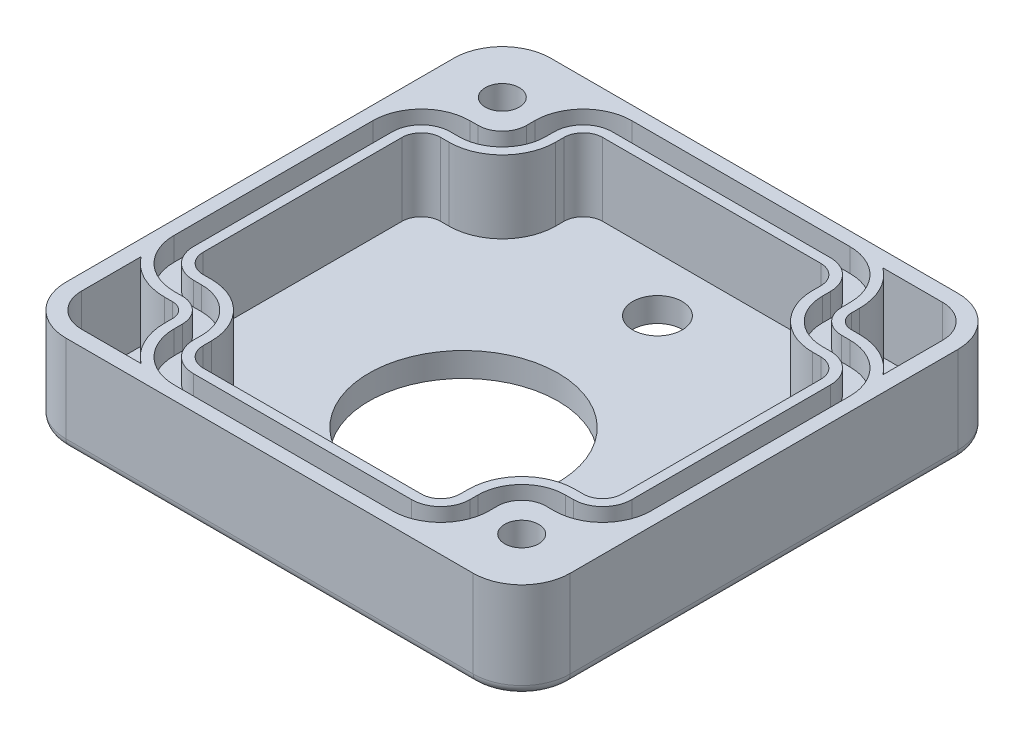
from build123d import *

# Parameters (mm, degrees)
EXTRUDE_1_DEPTH      = 10
CUT_EXTRUDE_START    = 2.5
CUT_EXTRUDE_1_DEPTH  = 7.5
CUT_EXTRUDE_START_2  = 10
CUT_EXTRUDE_7_DEPTH  = 2.4
CUT_EXTRUDE_START_3  = 2
CUT_EXTRUDE_9_DEPTH  = 8
SKETCH_15_R          = 1.75
CUT_EXTRUDE_10_DEPTH = 10
SKETCH_16_R          = 2.35
CUT_EXTRUDE_11_DEPTH = 6
SKETCH_17_R          = 4
CUT_EXTRUDE_12_DEPTH = 3
FILLET_2_R           = 1
SKETCH_18_R          = 9.75
SKETCH_18_R_2        = 2.55
CUT_EXTRUDE_13_DEPTH = 10


with BuildPart() as part:
    # Эскиз1 → Бобышка-Вытянуть1 (new body)
    with BuildSketch(Plane(origin=(0, 0, 0), x_dir=(1, 0, 0), z_dir=(0, 1, 0))):
        with BuildLine():
            Line((-21, 25), (21, 25))
            ThreePointArc((21, 25), (24.535533906, 23.535533906), (26, 20))
            Line((26, 20), (26, -20))
            ThreePointArc((26, -20), (24.535533906, -23.535533906), (21, -25))
            Line((21, -25), (-21, -25))
            ThreePointArc((-21, -25), (-24.535533906, -23.535533906), (-26, -20))
            Line((-26, -20), (-26, 20))
            ThreePointArc((-26, 20), (-24.535533906, 23.535533906), (-21, 25))
        make_face()
    extrude(amount=EXTRUDE_1_DEPTH)

    # Эскиз2 → Вырез-Вытянуть1 (cut)
    with BuildSketch(Plane(origin=(0, 0, 0), x_dir=(1, 0, 0), z_dir=(0, 1, 0)).offset(CUT_EXTRUDE_START)):
        with BuildLine():
            Line((-13.25, 18.6), (-13.25, 17.75))
            ThreePointArc((-13.25, 17.75), (-14.860912703, 13.860912703), (-18.75, 12.25))
            Line((-18.75, 12.25), (-19.6, 12.25))
            ThreePointArc((-19.6, 12.25), (-21.014213562, 11.664213562), (-21.6, 10.25))
            Line((-21.6, 10.25), (-21.6, -10.25))
            ThreePointArc((-21.6, -10.25), (-21.014213562, -11.664213562), (-19.6, -12.25))
            Line((-19.6, -12.25), (-18.75, -12.25))
            ThreePointArc((-18.75, -12.25), (-14.860912703, -13.860912703), (-13.25, -17.75))
            Line((-13.25, -17.75), (-13.25, -18.6))
            ThreePointArc((-13.25, -18.6), (-12.664213562, -20.014213562), (-11.25, -20.6))
            Line((-11.25, -20.6), (11.25, -20.6))
            ThreePointArc((11.25, -20.6), (12.664213562, -20.014213562), (13.25, -18.6))
            Line((13.25, -18.6), (13.25, -17.75))
            ThreePointArc((13.25, -17.75), (14.860912703, -13.860912703), (18.75, -12.25))
            Line((18.75, -12.25), (19.6, -12.25))
            ThreePointArc((19.6, -12.25), (21.014213562, -11.664213562), (21.6, -10.25))
            Line((21.6, -10.25), (21.6, 10.25))
            ThreePointArc((21.6, 10.25), (21.014213562, 11.664213562), (19.6, 12.25))
            Line((19.6, 12.25), (18.75, 12.25))
            ThreePointArc((18.75, 12.25), (14.860912703, 13.860912703), (13.25, 17.75))
            Line((13.25, 17.75), (13.25, 18.6))
            ThreePointArc((13.25, 18.6), (12.664213562, 20.014213562), (11.25, 20.6))
            Line((11.25, 20.6), (-11.25, 20.6))
            ThreePointArc((-11.25, 20.6), (-12.664213562, 20.014213562), (-13.25, 18.6))
        make_face()
    extrude(amount=CUT_EXTRUDE_1_DEPTH, mode=Mode.SUBTRACT)

    # Эскиз5 → Вырез-Вытянуть7 (cut)
    with BuildSketch(Plane(origin=(0, 0, 0), x_dir=(1, 0, 0), z_dir=(0, 1, 0)).offset(CUT_EXTRUDE_START_2)):
        with BuildLine():
            Line((-16.25, 18.6), (-16.25, 17.75))
            ThreePointArc((-16.25, 17.75), (-16.982233047, 15.982233047), (-18.75, 15.25))
            Line((-18.75, 15.25), (-19.6, 15.25))
            ThreePointArc((-19.6, 15.25), (-23.135533906, 13.785533906), (-24.6, 10.25))
            Line((-24.6, 10.25), (-24.6, -10.25))
            ThreePointArc((-24.6, -10.25), (-23.135533906, -13.785533906), (-19.6, -15.25))
            Line((-19.6, -15.25), (-18.75, -15.25))
            ThreePointArc((-18.75, -15.25), (-16.982233047, -15.982233047), (-16.25, -17.75))
            Line((-16.25, -17.75), (-16.25, -18.6))
            ThreePointArc((-16.25, -18.6), (-14.785533906, -22.135533906), (-11.25, -23.6))
            Line((-11.25, -23.6), (11.25, -23.6))
            ThreePointArc((11.25, -23.6), (14.785533906, -22.135533906), (16.25, -18.6))
            Line((16.25, -18.6), (16.25, -17.75))
            ThreePointArc((16.25, -17.75), (16.982233047, -15.982233047), (18.75, -15.25))
            Line((18.75, -15.25), (19.6, -15.25))
            ThreePointArc((19.6, -15.25), (23.135533906, -13.785533906), (24.6, -10.25))
            Line((24.6, -10.25), (24.6, 10.25))
            ThreePointArc((24.6, 10.25), (23.135533906, 13.785533906), (19.6, 15.25))
            Line((19.6, 15.25), (18.75, 15.25))
            ThreePointArc((18.75, 15.25), (16.982233047, 15.982233047), (16.25, 17.75))
            Line((16.25, 17.75), (16.25, 18.6))
            ThreePointArc((16.25, 18.6), (14.785533906, 22.135533906), (11.25, 23.6))
            Line((11.25, 23.6), (-11.25, 23.6))
            ThreePointArc((-11.25, 23.6), (-14.785533906, 22.135533906), (-16.25, 18.6))
        make_face()
        with BuildLine():
            Line((-14.25, 18.6), (-14.25, 17.75))
            ThreePointArc((-14.25, 17.75), (-15.568019485, 14.568019485), (-18.75, 13.25))
            Line((-18.75, 13.25), (-19.6, 13.25))
            ThreePointArc((-19.6, 13.25), (-21.721320344, 12.371320344), (-22.6, 10.25))
            Line((-22.6, 10.25), (-22.6, -10.25))
            ThreePointArc((-22.6, -10.25), (-21.721320344, -12.371320344), (-19.6, -13.25))
            Line((-19.6, -13.25), (-18.75, -13.25))
            ThreePointArc((-18.75, -13.25), (-15.568019485, -14.568019485), (-14.25, -17.75))
            Line((-14.25, -17.75), (-14.25, -18.6))
            ThreePointArc((-14.25, -18.6), (-13.371320344, -20.721320344), (-11.25, -21.6))
            Line((-11.25, -21.6), (11.25, -21.6))
            ThreePointArc((11.25, -21.6), (13.371320344, -20.721320344), (14.25, -18.6))
            Line((14.25, -18.6), (14.25, -17.75))
            ThreePointArc((14.25, -17.75), (15.568019485, -14.568019485), (18.75, -13.25))
            Line((18.75, -13.25), (19.6, -13.25))
            ThreePointArc((19.6, -13.25), (21.721320344, -12.371320344), (22.6, -10.25))
            Line((22.6, -10.25), (22.6, 10.25))
            ThreePointArc((22.6, 10.25), (21.721320344, 12.371320344), (19.6, 13.25))
            Line((19.6, 13.25), (18.75, 13.25))
            ThreePointArc((18.75, 13.25), (15.568019485, 14.568019485), (14.25, 17.75))
            Line((14.25, 17.75), (14.25, 18.6))
            ThreePointArc((14.25, 18.6), (13.371320344, 20.721320344), (11.25, 21.6))
            Line((11.25, 21.6), (-11.25, 21.6))
            ThreePointArc((-11.25, 21.6), (-13.371320344, 20.721320344), (-14.25, 18.6))
        make_face(mode=Mode.SUBTRACT)
    extrude(amount=-CUT_EXTRUDE_7_DEPTH, mode=Mode.SUBTRACT)

    # Эскиз14 → Вырез-Вытянуть9 (cut)
    with BuildSketch(Plane(origin=(0, 0, 0), x_dir=(1, 0, 0), z_dir=(0, 1, 0)).offset(CUT_EXTRUDE_START_3)):
        with BuildLine():
            Line((21, 23.4), (14.85, 23.4))
            ThreePointArc((14.85, 23.4), (16.616563146, 21.283281573), (17.25, 18.6))
            Line((17.25, 18.6), (17.25, 17.75))
            ThreePointArc((17.25, 17.75), (17.689339828, 16.689339828), (18.75, 16.25))
            Line((18.75, 16.25), (19.6, 16.25))
            ThreePointArc((19.6, 16.25), (22.283281573, 15.616563146), (24.4, 13.85))
            Line((24.4, 13.85), (24.4, 20))
            ThreePointArc((24.4, 20), (23.404163056, 22.404163056), (21, 23.4))
        make_face()
        with BuildLine():
            Line((-21, -23.4), (-14.85, -23.4))
            ThreePointArc((-14.85, -23.4), (-16.616563146, -21.283281573), (-17.25, -18.6))
            Line((-17.25, -18.6), (-17.25, -17.75))
            ThreePointArc((-17.25, -17.75), (-17.689339828, -16.689339828), (-18.75, -16.25))
            Line((-18.75, -16.25), (-19.6, -16.25))
            ThreePointArc((-19.6, -16.25), (-22.283281573, -15.616563146), (-24.4, -13.85))
            Line((-24.4, -13.85), (-24.4, -20))
            ThreePointArc((-24.4, -20), (-23.404163056, -22.404163056), (-21, -23.4))
        make_face()
    extrude(amount=CUT_EXTRUDE_9_DEPTH, mode=Mode.SUBTRACT)

    # Эскиз15 → Вырез-Вытянуть10 (cut)
    with BuildSketch(Plane(origin=(0, 0, 0), x_dir=(1, 0, 0), z_dir=(0, 1, 0))):
        with Locations(Location((-20, 19, 0), (0, 0, 90))):
            Circle(SKETCH_15_R)
        with Locations(Location((20, -19, 0), (0, 0, 90))):
            Circle(SKETCH_15_R)
    extrude(amount=CUT_EXTRUDE_10_DEPTH, mode=Mode.SUBTRACT)

    # Эскиз16 → Вырез-Вытянуть11 (cut)
    with BuildSketch(Plane(origin=(0, 0, 0), x_dir=(1, 0, 0), z_dir=(0, 1, 0))):
        with Locations(Location((-20, 19, 0), (0, 0, 270))):
            Circle(SKETCH_16_R)
        with Locations(Location((20, -19, 0), (0, 0, 270))):
            Circle(SKETCH_16_R)
    extrude(amount=CUT_EXTRUDE_11_DEPTH, mode=Mode.SUBTRACT)

    # Эскиз17 → Вырез-Вытянуть12 (cut)
    with BuildSketch(Plane(origin=(0, 0, 0), x_dir=(1, 0, 0), z_dir=(0, 1, 0))):
        with Locations(Location((-20, 19, 0), (0, 0, 270))):
            Circle(SKETCH_17_R)
        with Locations(Location((20, -19, 0), (0, 0, 270))):
            Circle(SKETCH_17_R)
    extrude(amount=CUT_EXTRUDE_12_DEPTH, mode=Mode.SUBTRACT)

    # Скругление2
    fillet_2_edges = [part.edges().sort_by_distance(p)[0] for p in [
        (0, 0, -25),
        (24.535533906, 0, -23.535533906),
        (26, 0, 0),
        (24.535533906, 0, 23.535533906),
        (0, 0, 25),
        (-24.535533906, 0, 23.535533906),
        (-26, 0, 0),
        (-24.535533906, 0, -23.535533906),
    ]]
    fillet(fillet_2_edges, radius=FILLET_2_R)

    # Эскиз18 → Вырез-Вытянуть13 (cut)
    with BuildSketch(Plane(origin=(0, 0, 0), x_dir=(1, 0, 0), z_dir=(0, 1, 0))):
        with Locations(Location((0, -5, 0), (0, 0, 90))):
            Circle(SKETCH_18_R)
        with Locations(Location((0, 15, 0), (0, 0, 90))):
            Circle(SKETCH_18_R_2)
    extrude(amount=CUT_EXTRUDE_13_DEPTH, mode=Mode.SUBTRACT)


solid = part.part
